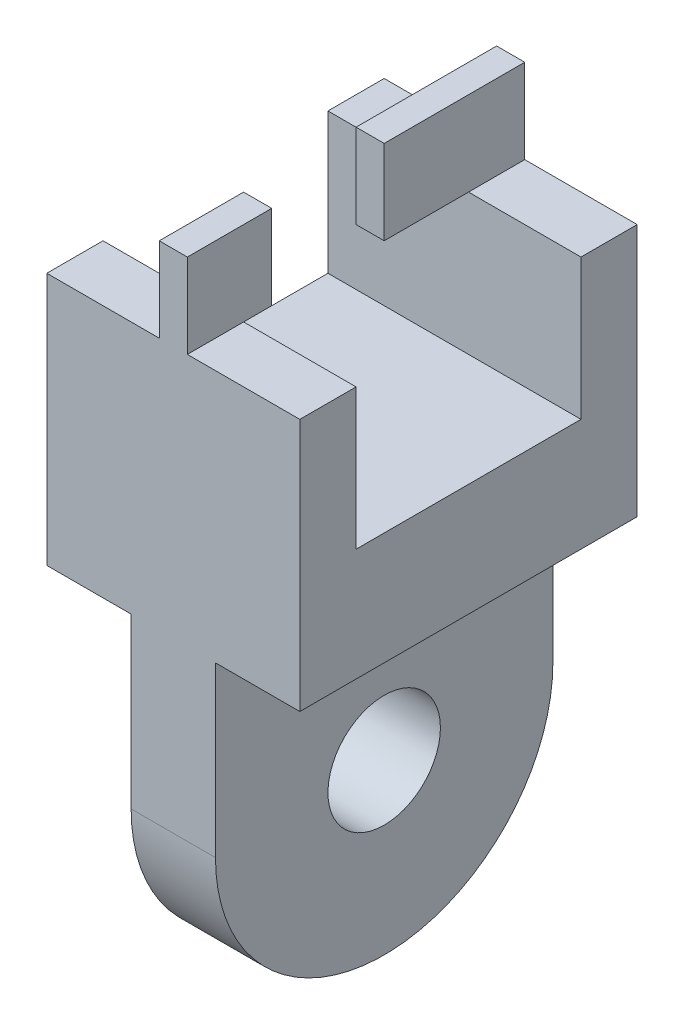
from build123d import *

# Parameters (mm, degrees)
SKETCH1_R           = 50
BOSS_EXTRUDE1_DEPTH = 112.5
SKETCH2_W           = 75
SKETCH2_H           = 300
SKETCH2_W_2         = 100
SKETCH2_H_2         = 75
CUT_EXTRUDE2_DEPTH  = 553.40949485


with BuildPart() as part:
    # Sketch1 → Boss-Extrude1 (new body)
    with BuildSketch(Plane.YZ):
        with BuildLine():
            Line((0, 150), (450, 150))
            Line((450, 150), (450, 75))
            Line((450, 75), (375, 75))
            Line((375, 75), (375, 100))
            Line((375, 100), (250, 100))
            Line((250, 100), (250, -100))
            Line((250, -100), (375, -100))
            Line((375, -100), (375, -25))
            Line((375, -25), (450, -25))
            Line((450, -25), (450, -150))
            Line((450, -150), (0, -150))
            ThreePointArc((0, -150), (-150, 0), (0, 150))
        make_face()
        with Locations(Location((0, 0, 0), (0, 0, 270))):
            Circle(SKETCH1_R, mode=Mode.SUBTRACT)
    extrude(amount=BOSS_EXTRUDE1_DEPTH)

    # Mirror1: part across plane


with BuildPart() as part_1:
    add(part.part)
    add(part.part.mirror(Plane(origin=(0, 0, 0), x_dir=(0, 0, 1), z_dir=(1, 0, 0))))

    # Sketch2 → Cut-Extrude2 (cut, through all)
    with BuildSketch(Plane.XY.offset(150)):
        with Locations((75, 0)):
            Rectangle(SKETCH2_W, SKETCH2_H)
        with Locations((62.5, 412.5)):
            Rectangle(SKETCH2_W_2, SKETCH2_H_2)
        with Locations((-75, 0)):
            Rectangle(SKETCH2_W, SKETCH2_H)
        with Locations((-62.5, 412.5)):
            Rectangle(SKETCH2_W_2, SKETCH2_H_2)
    extrude(amount=-CUT_EXTRUDE2_DEPTH, mode=Mode.SUBTRACT)


solid = part_1.part
